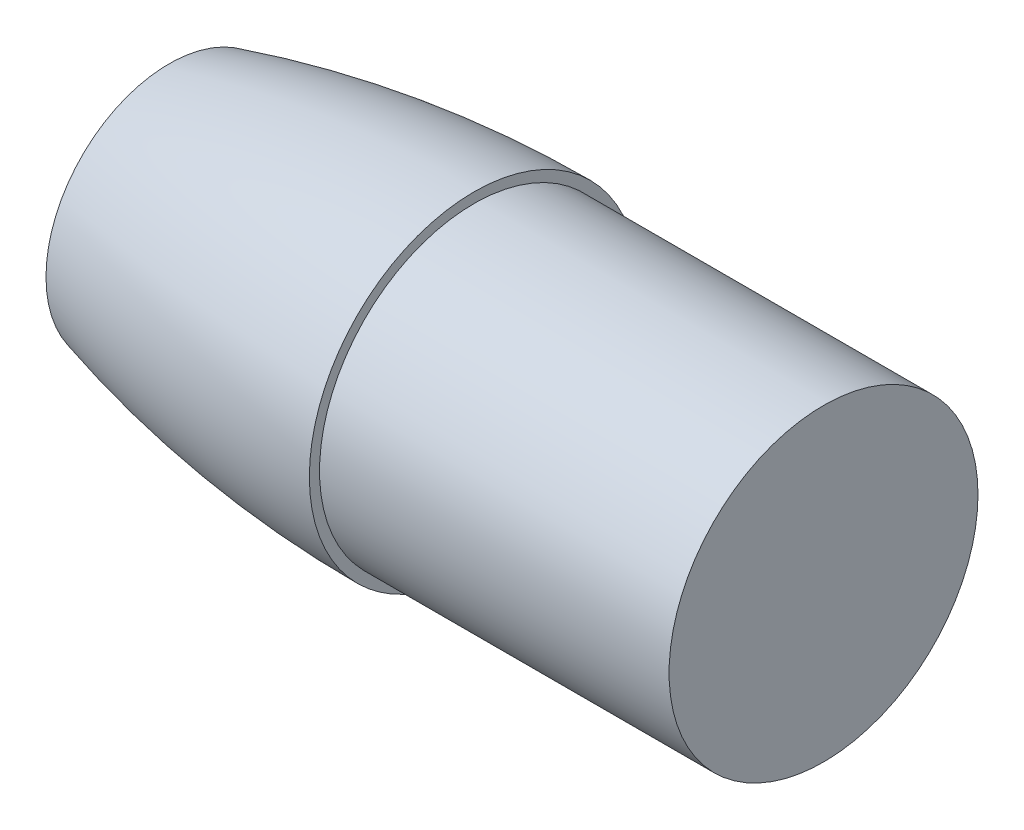
from build123d import *


with BuildPart() as part:
    # Sketch1 → Revolve1 (revolve)
    with BuildSketch(Plane.XY, mode=Mode.PRIVATE) as revolve1_sk:
        with BuildLine():
            Line((0, 278.127906977), (0, 280.627906977))
            ThreePointArc((0, 280.627906977), (-37.845738323, 278.064241255), (-75, 270.420084635))
            Line((-75, 270.420084635), (-75, 267.824817071))
            ThreePointArc((-75, 267.824817071), (-40.327501461, 275.188708462), (-5, 278.082959994))
            Line((-5, 278.082959994), (-5, 273.127906977))
            Line((-5, 273.127906977), (81, 273.127906977))
            Line((81, 273.127906977), (81, 245.127906977))
            Line((81, 245.127906977), (81, 240.127906977))
            Line((81, 240.127906977), (86, 240.127906977))
            Line((86, 240.127906977), (86, 278.127906977))
            Line((86, 278.127906977), (0, 278.127906977))
        make_face()
    revolve(revolve1_sk.sketch.rotate(Axis((-150, 240.127906977, 0), (-1, 0, 0)), 90), axis=Axis((-150, 240.127906977, 0), (-1, 0, 0)))


solid = part.part
